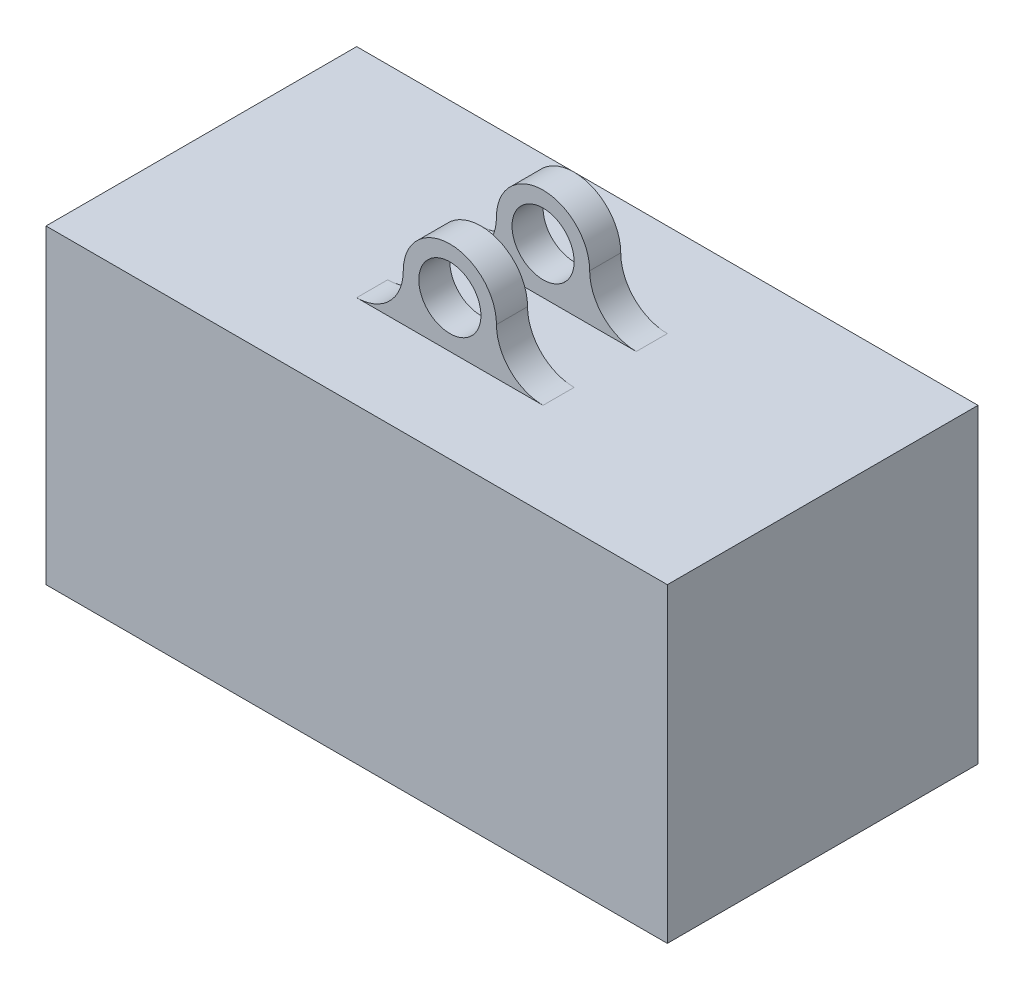
from build123d import *

# Parameters (mm, degrees)
EXTRUDE_1_DEPTH          = 2.5
EXTRUDE_1_DEPTH_BACK     = 2.5
EXTRUDE_3_DEPTH          = 1
EXTRUDE_3_DEPTH_BACK     = 1
SKETCH_2_6_R             = 0.5
CUT_EXTRUDE_1_DEPTH      = 0.5
CUT_EXTRUDE_1_DEPTH_BACK = 0.5
SKETCH_2_R               = 0.5


with BuildPart() as part:
    # 草圖1 → 填料-伸長1 (new, two sides: drawn at the far end of the back side and taken through both)
    with BuildSketch(Plane.XY.offset(-EXTRUDE_1_DEPTH_BACK)):
        Polygon((2, 5), (0, 5), (0, 0), (10, 0), (10, 5), (8, 5), align=None)
    extrude(amount=EXTRUDE_1_DEPTH + EXTRUDE_1_DEPTH_BACK)

    # 草圖2<6> → 填料-伸長3 (add, two sides: drawn at the far end of the back side and taken through both)
    with BuildSketch(Plane.XY.offset(-EXTRUDE_3_DEPTH_BACK)):
        with BuildLine():
            Line((3.5, 5), (6.5, 5))
            ThreePointArc((6.5, 5), (5.969669914, 5.219669914), (5.75, 5.75))
            ThreePointArc((5.75, 5.75), (5, 6.5), (4.25, 5.75))
            ThreePointArc((4.25, 5.75), (4.030330086, 5.219669914), (3.5, 5))
        make_face()
        with Locations((5, 5.75)):
            Circle(SKETCH_2_6_R, mode=Mode.SUBTRACT)
    extrude(amount=EXTRUDE_3_DEPTH + EXTRUDE_3_DEPTH_BACK)

    # 草圖2 → 除料-伸長1 (cut, two sides: drawn at the far end of the back side and taken through both)
    with BuildSketch(Plane.XY.offset(-CUT_EXTRUDE_1_DEPTH_BACK)):
        with BuildLine():
            Line((3.5, 5), (6.5, 5))
            ThreePointArc((6.5, 5), (5.969669914, 5.219669914), (5.75, 5.75))
            ThreePointArc((5.75, 5.75), (5, 6.5), (4.25, 5.75))
            ThreePointArc((4.25, 5.75), (4.030330086, 5.219669914), (3.5, 5))
        make_face()
        with Locations((5, 5.75)):
            Circle(SKETCH_2_R, mode=Mode.SUBTRACT)
    extrude(amount=CUT_EXTRUDE_1_DEPTH + CUT_EXTRUDE_1_DEPTH_BACK, mode=Mode.SUBTRACT)


solid = part.part
